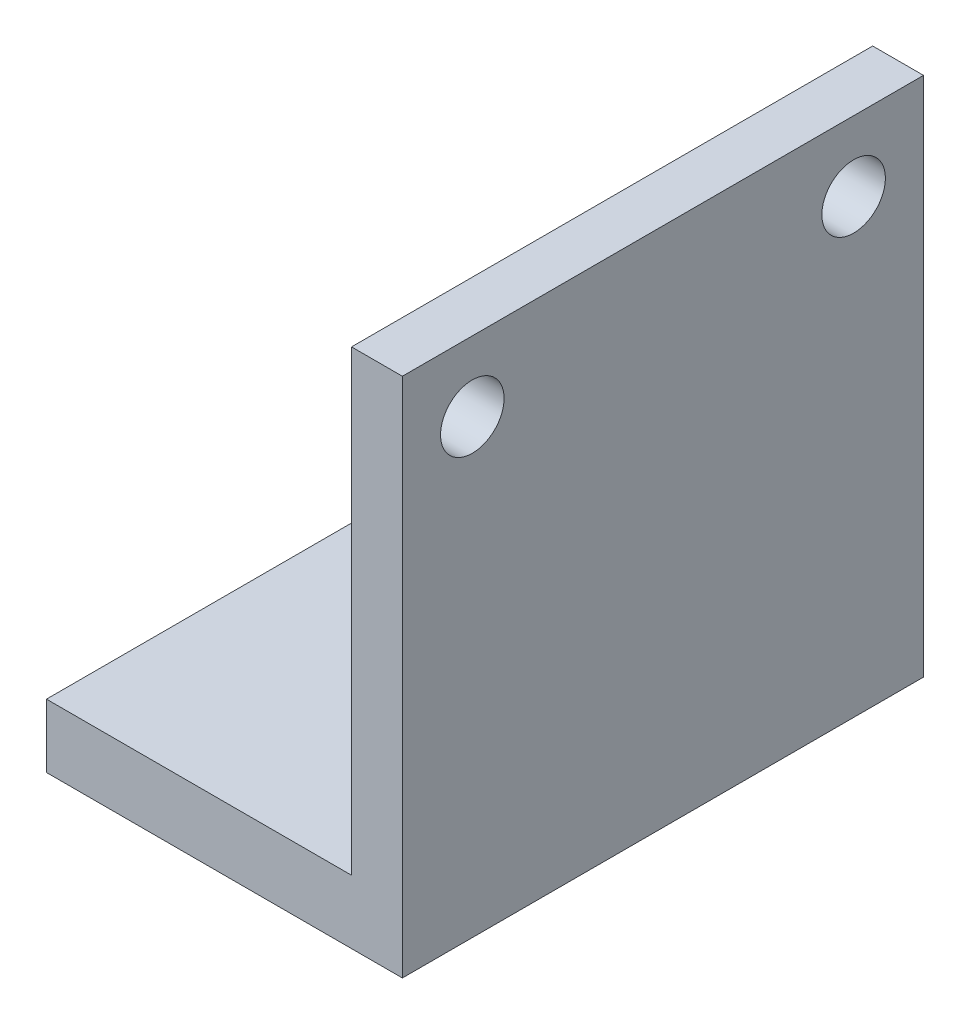
from build123d import *

# Parameters (mm, degrees)
SKETCH1_W           = 20.5
SKETCH1_H           = 20.5
SKETCH1_R           = 1.25
BOSS_EXTRUDE1_DEPTH = 2
SKETCH2_W           = 20.5
SKETCH2_H           = 2.5
BOSS_EXTRUDE2_DEPTH = 12


with BuildPart() as part:
    # Sketch1 → Boss-Extrude1 (new body)
    with BuildSketch(Plane(origin=(0, 0, 0), x_dir=(0, 0, -1), z_dir=(1, 0, 0))):
        Rectangle(SKETCH1_W, SKETCH1_H)
        with Locations((-7.5, 7.5)):
            Circle(SKETCH1_R, mode=Mode.SUBTRACT)
        with Locations((7.5, 7.5)):
            Circle(SKETCH1_R, mode=Mode.SUBTRACT)
    extrude(amount=BOSS_EXTRUDE1_DEPTH)

    # Sketch2 → Boss-Extrude2 (add)
    with BuildSketch(Plane.ZY):
        with Locations((0, -9)):
            Rectangle(SKETCH2_W, SKETCH2_H)
    extrude(amount=BOSS_EXTRUDE2_DEPTH)


solid = part.part
